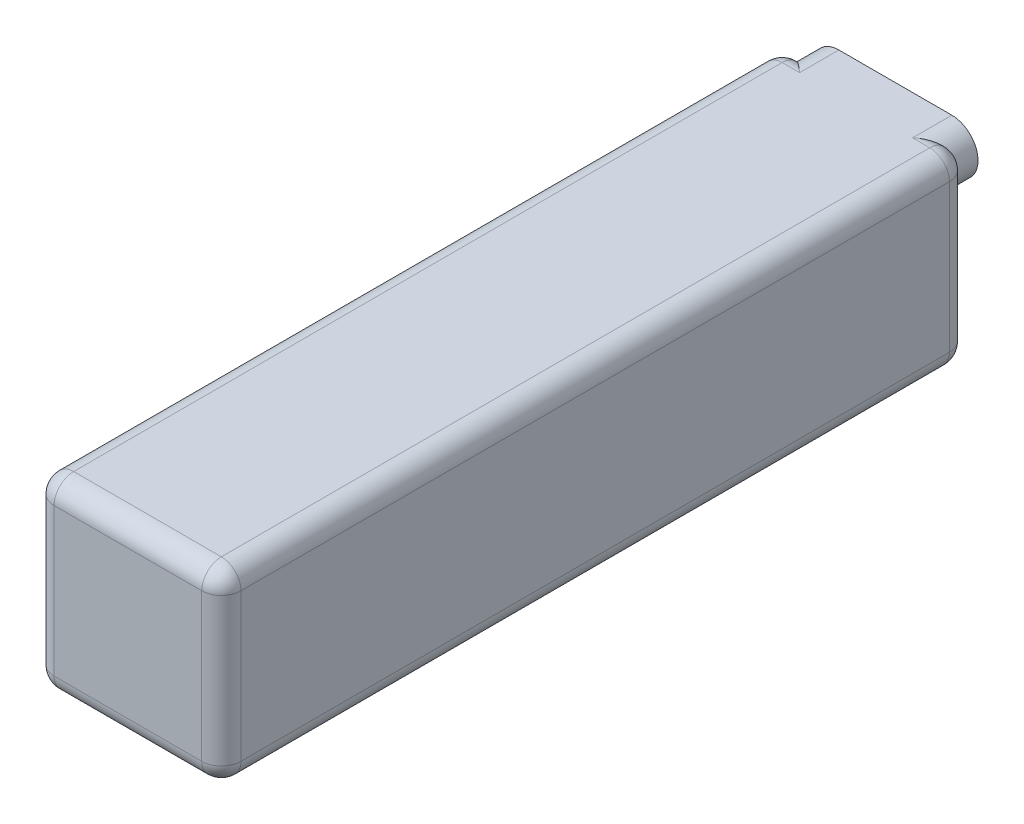
from build123d import *

# Parameters (mm, degrees)
SKETCH1_W                       = 76.2
SKETCH1_H                       = 19.05
BOSS_EXTRUDE1_DEPTH             = 9.525
FILLET1_R                       = 2
BOSS_EXTRUDE2_DEPTH             = 2
BOSS_EXTRUDE2_DIRECTION_2_REACH = 79.381


with BuildPart() as part:
    # Sketch1 → Boss-Extrude1 (new, symmetric)
    with BuildSketch(Plane(origin=(0, 0, 0), x_dir=(0, 0, -1), z_dir=(1, 0, 0))):
        Rectangle(SKETCH1_W, SKETCH1_H)
    extrude(amount=BOSS_EXTRUDE1_DEPTH, both=True)

    # Fillet1
    fillet1_edges = [part.edges().sort_by_distance(p)[0] for p in [
        (9.525, 0, 38.1),
        (9.525, -9.525, 0),
        (9.525, 0, -38.1),
        (-9.525, -9.525, 0),
        (-9.525, 0, 38.1),
        (-9.525, 9.525, 0),
        (-9.525, 0, -38.1),
        (0, -9.525, -38.1),
        (0, -9.525, 38.1),
        (0, 9.525, 38.1),
        (0, 9.525, -38.1),
        (9.525, 9.525, 0),
    ]]
    fillet(fillet1_edges, radius=FILLET1_R)

    # Sketch2 → Boss-Extrude2 (add)
    with BuildSketch(Plane(origin=(0, 0, -38.1), x_dir=(-1, 0, 0), z_dir=(0, 0, -1))):
        with BuildLine():
            Line((-5.771898524, 9.525), (5.739747172, 9.525))
            ThreePointArc((5.739747172, 9.525), (8.406747172, 6.858), (5.739747172, 4.191))
            Line((5.739747172, 4.191), (-5.771898524, 4.191))
            ThreePointArc((-5.771898524, 4.191), (-8.438898524, 6.858), (-5.771898524, 9.525))
        make_face()
    extrude(amount=BOSS_EXTRUDE2_DEPTH)

    # Sketch2 → Boss-Extrude2 direction 2 (add, up to next)
    with BuildSketch(Plane(origin=(0, 0, -38.1), x_dir=(-1, 0, 0), z_dir=(0, 0, -1)), mode=Mode.PRIVATE) as boss_extrude2_direction_2_sk1:
        with BuildLine():
            Line((-5.771898524, 9.525), (5.739747172, 9.525))
            ThreePointArc((5.739747172, 9.525), (8.406747172, 6.858), (5.739747172, 4.191))
            Line((5.739747172, 4.191), (-5.771898524, 4.191))
            ThreePointArc((-5.771898524, 4.191), (-8.438898524, 6.858), (-5.771898524, 9.525))
        make_face()
    boss_extrude2_direction_2_tool1 = extrude(boss_extrude2_direction_2_sk1.sketch, amount=-BOSS_EXTRUDE2_DIRECTION_2_REACH, mode=Mode.PRIVATE) - part.part
    add(boss_extrude2_direction_2_tool1.solids().sort_by_distance((0.016076, 6.858, -38.1))[0])


solid = part.part
